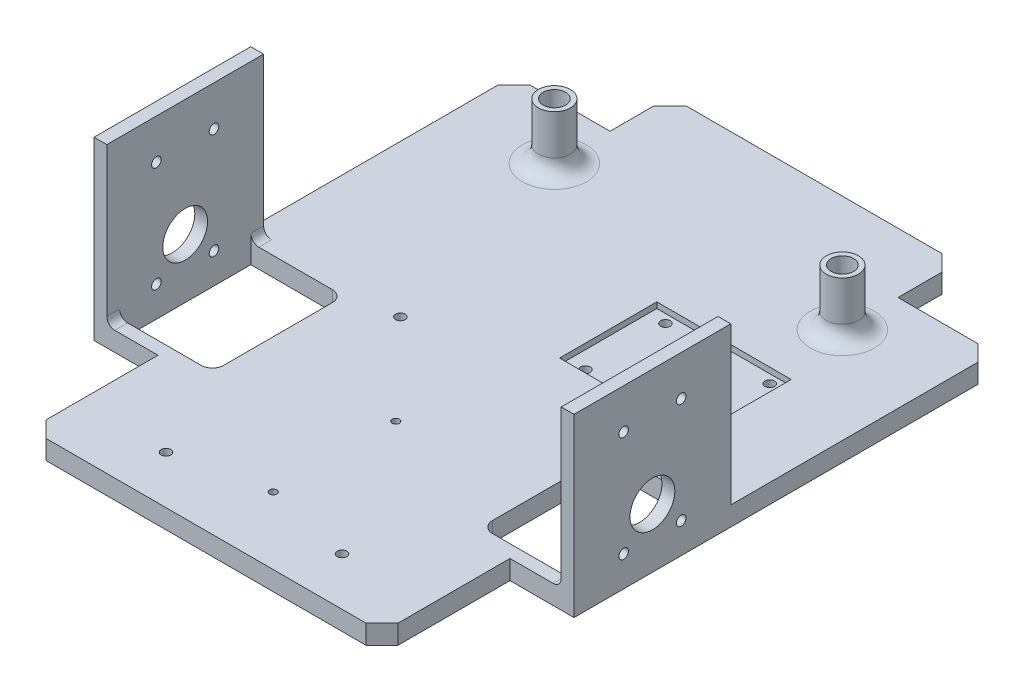
from build123d import *

# Parameters (mm, degrees)
SKETCH1_W                        = 150
SKETCH1_H                        = 190
BOSS_EXTRUDE1_DEPTH              = 6
SKETCH2_W                        = 30
SKETCH2_H                        = 18.75
CUT_EXTRUDE1_DEPTH               = 6
CHAMFER1_SIZE                    = 5
SKETCH3_W                        = 20
SKETCH3_H                        = 40
CUT_EXTRUDE2_DEPTH               = 6
SKETCH5_R                        = 1.125
CUT_EXTRUDE4_DEPTH               = 3.75
SKETCH9_R                        = 5
POLE_SUPPORTS_DEPTH              = 17.5
FILLET1_R                        = 5
SKETCH10_R                       = 3.5
POLE_SUPPORT_HOLE_LEFT_DEPTH     = 17.5
SKETCH11_R                       = 3.5
POLE_SUPPORT_HOLE_RIGHT_DEPTH    = 17.5
SKETCH12_R                       = 2
POLE_SUPPORT_SCREW_DEPTH         = 6
SKETCH13_W                       = 42
SKETCH13_H                       = 30.4
PULLEY_MOUNT_DEPTH               = 1.8
SKETCH15_R                       = 1.5
PULLEY_MOUNT_SCREWS_DEPTH        = 4.7
SKETCH16_W                       = 4
SKETCH16_H                       = 49
MOTOR_MOUNTS_DEPTH               = 49
SKETCH17_R                       = 7
SKETCH17_R_2                     = 1.5
MOTOR_MOUNTING_HOLES_LEFT_DEPTH  = 4
SKETCH18_W                       = 29
SKETCH18_H                       = 41
MOTOR_CUTOUT_LEFT_DEPTH          = 6.5
FILLET2_R                        = 2.5
MOTOR_START                      = -4
SKETCH20_R                       = 7
SKETCH20_R_2                     = 1.5
MOTOR_MOUNTING_HOLES_RIGHT_DEPTH = 4
SKETCH21_W                       = 29
SKETCH21_H                       = 41
MOTOR_CUTOUT_RIGHT_DEPTH         = 6
FILLET3_R                        = 2.5
SKETCH23_R                       = 1.5
ARDUINO_MOUNTING_HOLES_DEPTH     = 6
SKETCH24_R                       = 4
CUT_EXTRUDE20_DEPTH              = 2
CHAMFER2_SIZE                    = 5
FILLET4_R                        = 3.5


with BuildPart() as part:
    # Sketch1 → Boss-Extrude1 (new body)
    with BuildSketch(Plane(origin=(0, 0, 0), x_dir=(1, 0, 0), z_dir=(0, 1, 0))):
        Rectangle(SKETCH1_W, SKETCH1_H)
    extrude(amount=BOSS_EXTRUDE1_DEPTH)

    # Sketch2 → Cut-Extrude1 (cut)
    with BuildSketch(Plane(origin=(0, 6, 0), x_dir=(1, 0, 0), z_dir=(0, 1, 0))):
        with Locations((-60, 85.625)):
            Rectangle(SKETCH2_W, SKETCH2_H)
        with Locations((60, 85.625)):
            Rectangle(SKETCH2_W, SKETCH2_H)
    extrude(amount=-CUT_EXTRUDE1_DEPTH, mode=Mode.SUBTRACT)

    # Chamfer1
    chamfer1_edges = [part.edges().sort_by_distance(p)[0] for p in [
        (-75, 3, -76.25),
        (-45, 3, -95),
        (75, 3, -76.25),
        (45, 3, -95),
    ]]
    chamfer(chamfer1_edges, length=CHAMFER1_SIZE)

    # Sketch3 → Cut-Extrude2 (cut)
    with BuildSketch(Plane(origin=(0, 6, 0), x_dir=(1, 0, 0), z_dir=(0, 1, 0))):
        with Locations((-65, -75)):
            Rectangle(SKETCH3_W, SKETCH3_H)
        with Locations((65, -75)):
            Rectangle(SKETCH3_W, SKETCH3_H)
    extrude(amount=-CUT_EXTRUDE2_DEPTH, mode=Mode.SUBTRACT)

    # Sketch5 → Cut-Extrude4 (cut)
    with BuildSketch(Plane(origin=(0, 6, 0), x_dir=(1, 0, 0), z_dir=(0, 1, 0))):
        with Locations(Location((0, -74, 0), (0, 0, 270))):
            Circle(SKETCH5_R)
        with Locations(Location((0, -35.7, 0), (0, 0, 270))):
            Circle(SKETCH5_R)
    extrude(amount=-CUT_EXTRUDE4_DEPTH, mode=Mode.SUBTRACT)

    # Sketch9 → Pole supports (add)
    with BuildSketch(Plane(origin=(0, 6, 0), x_dir=(1, 0, 0), z_dir=(0, 1, 0))):
        with Locations(Location((-45, 58.865040338, 0), (0, 0, 270))):
            Circle(SKETCH9_R)
        with Locations(Location((45, 58.865040338, 0), (0, 0, 270))):
            Circle(SKETCH9_R)
    extrude(amount=POLE_SUPPORTS_DEPTH)

    # Fillet1
    fillet1_edges = [part.edges().sort_by_distance(p)[0] for p in [
        (-45, 6, -63.865040338),
        (45, 6, -63.865040338),
    ]]
    fillet(fillet1_edges, radius=FILLET1_R)

    # Sketch10 → Pole support hole - left (cut)
    with BuildSketch(Plane(origin=(0, 23.5, 0), x_dir=(1, 0, 0), z_dir=(0, 1, 0))):
        with Locations(Location((-45, 58.865040338, 0), (0, 0, 270))):
            Circle(SKETCH10_R)
    extrude(amount=-POLE_SUPPORT_HOLE_LEFT_DEPTH, mode=Mode.SUBTRACT)

    # Sketch11 → Pole support hole - right (cut)
    with BuildSketch(Plane(origin=(0, 23.5, 0), x_dir=(1, 0, 0), z_dir=(0, 1, 0))):
        with Locations(Location((45, 58.865040338, 0), (0, 0, 270))):
            Circle(SKETCH11_R)
    extrude(amount=-POLE_SUPPORT_HOLE_RIGHT_DEPTH, mode=Mode.SUBTRACT)

    # Sketch12 → Pole support screw (cut)
    with BuildSketch(Plane(origin=(0, 6, 0), x_dir=(1, 0, 0), z_dir=(0, 1, 0))):
        with Locations(Location((-45, 58.865040338, 0), (0, 0, 270))):
            Circle(SKETCH12_R)
        with Locations(Location((45, 58.865040338, 0), (0, 0, 270))):
            Circle(SKETCH12_R)
    extrude(amount=-POLE_SUPPORT_SCREW_DEPTH, mode=Mode.SUBTRACT)

    # Sketch13 → Pulley mount (cut)
    with BuildSketch(Plane(origin=(0, 6, 0), x_dir=(1, 0, 0), z_dir=(0, 1, 0))):
        with Locations((29.5, 22.18)):
            Rectangle(SKETCH13_W, SKETCH13_H)
    extrude(amount=-PULLEY_MOUNT_DEPTH, mode=Mode.SUBTRACT)

    # Sketch15 → Pulley mount screws (cut)
    with BuildSketch(Plane(origin=(0, 4.2, 0), x_dir=(1, 0, 0), z_dir=(0, 1, 0))):
        with Locations(Location((13.9, 34.68, 0), (0, 0, 270))):
            Circle(SKETCH15_R)
        with Locations(Location((46.5, 34.68, 0), (0, 0, 270))):
            Circle(SKETCH15_R)
        with Locations(Location((46.5, 9.68, 0), (0, 0, 270))):
            Circle(SKETCH15_R)
        with Locations(Location((13.9, 9.68, 0), (0, 0, 270))):
            Circle(SKETCH15_R)
    extrude(amount=-PULLEY_MOUNT_SCREWS_DEPTH, mode=Mode.SUBTRACT)

    # Sketch16 → Motor mounts (add)
    with BuildSketch(Plane(origin=(0, 6, 0), x_dir=(1, 0, 0), z_dir=(0, 1, 0))):
        with Locations((-73, -30.5)):
            Rectangle(SKETCH16_W, SKETCH16_H)
        with Locations((73, -30.5)):
            Rectangle(SKETCH16_W, SKETCH16_H)
    extrude(amount=MOTOR_MOUNTS_DEPTH)

    # Sketch17 → Motor mounting holes - left (cut)
    with BuildSketch(Plane(origin=(-71, 0, 0), x_dir=(0, 0, -1), z_dir=(1, 0, 0))):
        with Locations((-30.5, 18.5)):
            Circle(SKETCH17_R)
        with Locations((-39.5, 9.5)):
            Circle(SKETCH17_R_2)
        with Locations((-21.5, 9.5)):
            Circle(SKETCH17_R_2)
        with Locations((-39.5, 42.5)):
            Circle(SKETCH17_R_2)
        with Locations((-21.5, 42.5)):
            Circle(SKETCH17_R_2)
    extrude(amount=-MOTOR_MOUNTING_HOLES_LEFT_DEPTH, mode=Mode.SUBTRACT)

    # Sketch18 → Motor cutout - left (cut)
    with BuildSketch(Plane(origin=(0, 6, 0), x_dir=(1, 0, 0), z_dir=(0, 1, 0))):
        with Locations((-56.5, -30.5)):
            Rectangle(SKETCH18_W, SKETCH18_H)
    extrude(amount=-MOTOR_CUTOUT_LEFT_DEPTH, mode=Mode.SUBTRACT)

    # Fillet2
    fillet2_edges = [part.edges().sort_by_distance(p)[0] for p in [
        (-71, 6, 53),
        (-71, 6, 8),
    ]]
    fillet(fillet2_edges, radius=FILLET2_R)

    # Sketch20 → Motor mounting holes - right (cut)
    with BuildSketch(Plane.ZY.offset(-71).offset(MOTOR_START)):
        with Locations(Location((30.5, 18.5, 0), (0, 0, 180))):
            Circle(SKETCH20_R)
        with Locations(Location((21.5, 9.5, 0), (0, 0, 180))):
            Circle(SKETCH20_R_2)
        with Locations(Location((39.5, 9.5, 0), (0, 0, 180))):
            Circle(SKETCH20_R_2)
        with Locations(Location((21.5, 42.5, 0), (0, 0, 180))):
            Circle(SKETCH20_R_2)
        with Locations(Location((39.5, 42.5, 0), (0, 0, 180))):
            Circle(SKETCH20_R_2)
    extrude(amount=MOTOR_MOUNTING_HOLES_RIGHT_DEPTH, mode=Mode.SUBTRACT)

    # Sketch21 → Motor cutout - right (cut)
    with BuildSketch(Plane(origin=(0, 6, 0), x_dir=(1, 0, 0), z_dir=(0, 1, 0))):
        with Locations((56.5, -30.5)):
            Rectangle(SKETCH21_W, SKETCH21_H)
    extrude(amount=-MOTOR_CUTOUT_RIGHT_DEPTH, mode=Mode.SUBTRACT)

    # Fillet3
    fillet3_edges = [part.edges().sort_by_distance(p)[0] for p in [
        (71, 6, 8),
        (71, 6, 53),
    ]]
    fillet(fillet3_edges, radius=FILLET3_R)

    # Sketch23 → Arduino mounting holes (cut)
    with BuildSketch(Plane(origin=(0, 6, 0), x_dir=(1, 0, 0), z_dir=(0, 1, 0))):
        with Locations(Location((-27.5, -6.754956847, 0), (0, 0, 270))):
            Circle(SKETCH23_R)
        with Locations(Location((27.5, -6.754956847, 0), (0, 0, 270))):
            Circle(SKETCH23_R)
        with Locations(Location((-27.5, -80, 0), (0, 0, 270))):
            Circle(SKETCH23_R)
        with Locations(Location((27.5, -80, 0), (0, 0, 270))):
            Circle(SKETCH23_R)
    extrude(amount=-ARDUINO_MOUNTING_HOLES_DEPTH, mode=Mode.SUBTRACT)

    # Sketch24 → Cut-Extrude20 (cut)
    with BuildSketch(Plane.XZ):
        with Locations(Location((45, -58.865040338, 0), (0, 0, 270))):
            Circle(SKETCH24_R)
        with Locations(Location((-45, -58.865040338, 0), (0, 0, 270))):
            Circle(SKETCH24_R)
    extrude(amount=-CUT_EXTRUDE20_DEPTH, mode=Mode.SUBTRACT)

    # Chamfer2
    chamfer2_edges = [part.edges().sort_by_distance(p)[0] for p in [
        (-55, 3, 95),
        (55, 3, 95),
    ]]
    chamfer(chamfer2_edges, length=CHAMFER2_SIZE)

    # Fillet4
    fillet4_edges = [part.edges().sort_by_distance(p)[0] for p in [
        (-42, 3, 10),
        (-42, 3, 51),
        (42, 3, 51),
        (42, 3, 10),
    ]]
    fillet(fillet4_edges, radius=FILLET4_R)


solid = part.part
